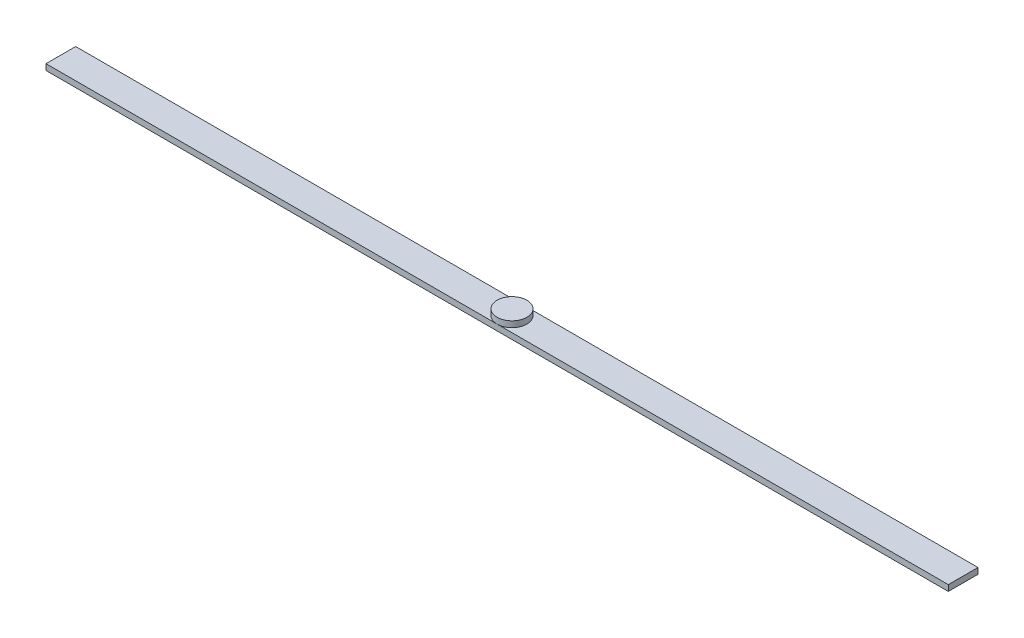
from build123d import *

# Parameters (mm, degrees)
SKETCH_1_W      = 304
SKETCH_1_H      = 10
EXTRUDE_1_DEPTH = 2
SKETCH_2_R      = 5
EXTRUDE_2_DEPTH = 2


with BuildPart() as part:
    # 草图1 → 凸台-拉伸1 (new body)
    with BuildSketch(Plane(origin=(0, 0, 0), x_dir=(1, 0, 0), z_dir=(0, 1, 0))):
        Rectangle(SKETCH_1_W, SKETCH_1_H)
    extrude(amount=EXTRUDE_1_DEPTH)

    # 草图2 → 凸台-拉伸2 (add)
    with BuildSketch(Plane(origin=(0, 2, 0), x_dir=(1, 0, 0), z_dir=(0, 1, 0))):
        with Locations(Location((0, 0, 0), (0, 0, 270))):
            Circle(SKETCH_2_R)
    extrude(amount=EXTRUDE_2_DEPTH)


solid = part.part
